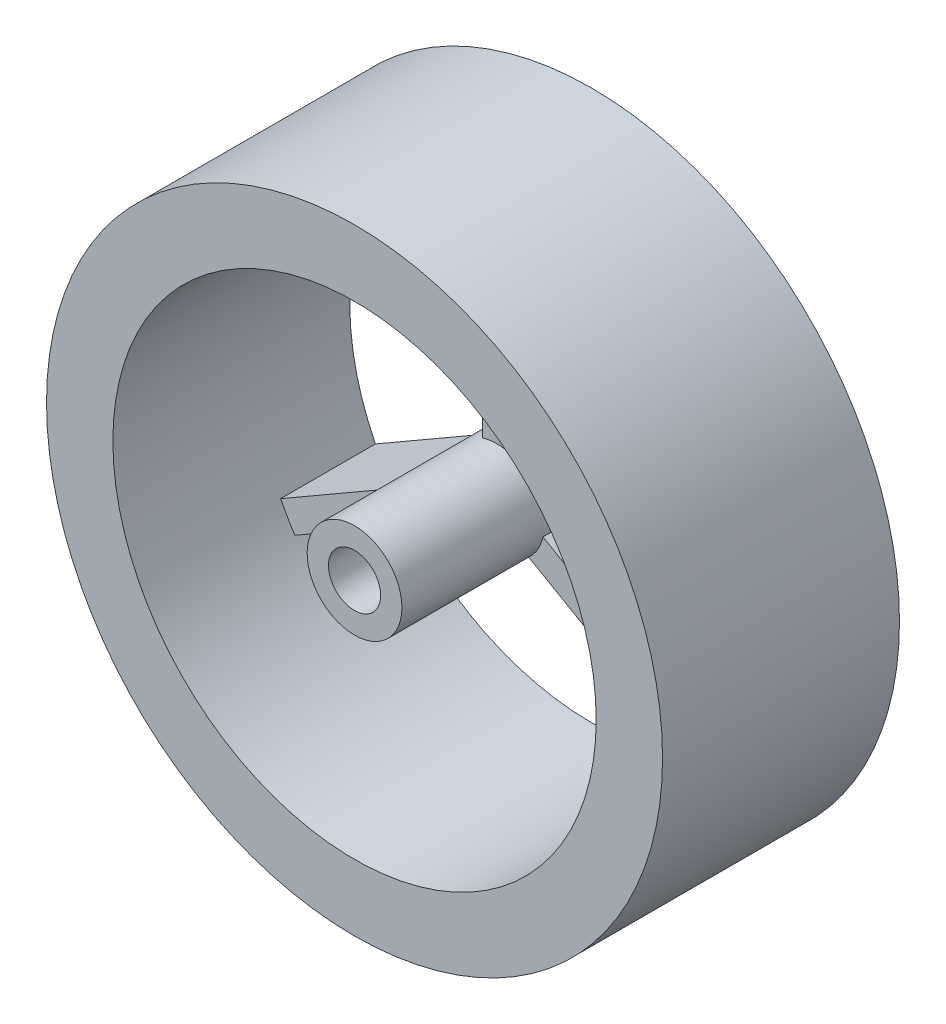
from build123d import *

# Parameters (mm, degrees)
SKETCH_1_R      = 32.5
SKETCH_1_R_2    = 25.5
EXTRUDE_1_DEPTH = 25
EXTRUDE_2_DEPTH = 10
SKETCH_2_3_R    = 2.75
EXTRUDE_3_DEPTH = 25


with BuildPart() as part:
    # 草图1 → 凸台-拉伸1 (new body)
    with BuildSketch(Plane.XY):
        Circle(SKETCH_1_R)
        Circle(SKETCH_1_R_2, mode=Mode.SUBTRACT)
    extrude(amount=EXTRUDE_1_DEPTH)

    # 草图2 → 凸台-拉伸2 (add)
    with BuildSketch(Plane.XY):
        with BuildLine():
            Line((-1.5, 25.455844123), (-1.5, 4.769696007))
            ThreePointArc((-1.5, 4.769696007), (0, 5), (1.5, 4.769696007))
            Line((1.5, 4.769696007), (1.5, 25.455844123))
            ThreePointArc((1.5, 25.455844123), (0, 25.5), (-1.5, 25.455844123))
        make_face()
        with BuildLine():
            ThreePointArc((-3.38067791, -3.683886109), (-4.330127019, -2.5), (-4.88067791, -1.085809898))
            Line((-4.88067791, -1.085809898), (-22.795407685, -11.428883956))
            ThreePointArc((-22.795407685, -11.428883956), (-22.083647797, -12.75), (-21.295407685, -14.026960167))
            Line((-21.295407685, -14.026960167), (-3.38067791, -3.683886109))
        make_face()
        with BuildLine():
            ThreePointArc((4.88067791, -1.085809898), (4.330127019, -2.5), (3.38067791, -3.683886109))
            Line((3.38067791, -3.683886109), (21.295407685, -14.026960167))
            ThreePointArc((21.295407685, -14.026960167), (22.083647797, -12.75), (22.795407685, -11.428883956))
            Line((22.795407685, -11.428883956), (4.88067791, -1.085809898))
        make_face()
    extrude(amount=EXTRUDE_2_DEPTH)

    # 草图2<3> → 凸台-拉伸3 (add)
    with BuildSketch(Plane.XY):
        with BuildLine():
            ThreePointArc((1.5, 4.769696007), (0, 5), (-1.5, 4.769696007))
            ThreePointArc((-1.5, 4.769696007), (-4.330127019, 2.5), (-4.88067791, -1.085809898))
            ThreePointArc((-4.88067791, -1.085809898), (-4.330127019, -2.5), (-3.38067791, -3.683886109))
            ThreePointArc((-3.38067791, -3.683886109), (0, -5), (3.38067791, -3.683886109))
            ThreePointArc((3.38067791, -3.683886109), (4.330127019, -2.5), (4.88067791, -1.085809898))
            ThreePointArc((4.88067791, -1.085809898), (4.970079957, -0.546173254), (5, 0))
            ThreePointArc((5, 0), (4.031128874, 2.958039892), (1.5, 4.769696007))
        make_face()
        Circle(SKETCH_2_3_R, mode=Mode.SUBTRACT)
    extrude(amount=EXTRUDE_3_DEPTH)


solid = part.part
